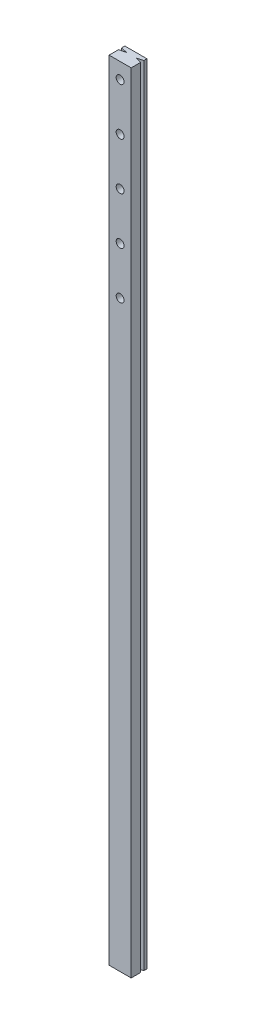
from build123d import *

# Parameters (mm, degrees)
EXTRUDE_1_DEPTH        = 250
SKETCH_2_R             = 1.25
CUT_EXTRUDE_3_DEPTH    = 251.074488903
PATTERN_LINEAR_1_COUNT = 5
PATTERN_LINEAR_1_PITCH = 15


with BuildPart() as part:
    # 草图1 → 凸台-拉伸1 (new body)
    with BuildSketch(Plane(origin=(0, 0, 0), x_dir=(1, 0, 0), z_dir=(0, 1, 0))):
        Polygon((-3.5, 1.5), (-1.5, 1), (-3.5, 0.5), (-3.5, -2.5), (3.5, -2.5), (3.5, 0.5), (1.5, 1), (3.5, 1.5), (3.5, 2.5), (-3.5, 2.5), align=None)
    extrude(amount=EXTRUDE_1_DEPTH)

    # 草图2 → 切除-拉伸3 (cut, through all)
    with BuildSketch(Plane(origin=(0, 0, -2.5), x_dir=(-1, 0, 0), z_dir=(0, 0, -1))):
        with Locations((0, 245)):
            Circle(SKETCH_2_R)
    cut_extrude_3 = extrude(amount=-CUT_EXTRUDE_3_DEPTH, mode=Mode.SUBTRACT)

    # 阵列(线性)1: 切除-拉伸3 ×5
    with Locations(*[(0, -i * PATTERN_LINEAR_1_PITCH, 0) for i in range(1, PATTERN_LINEAR_1_COUNT)]):
        add(cut_extrude_3, mode=Mode.SUBTRACT)


solid = part.part
